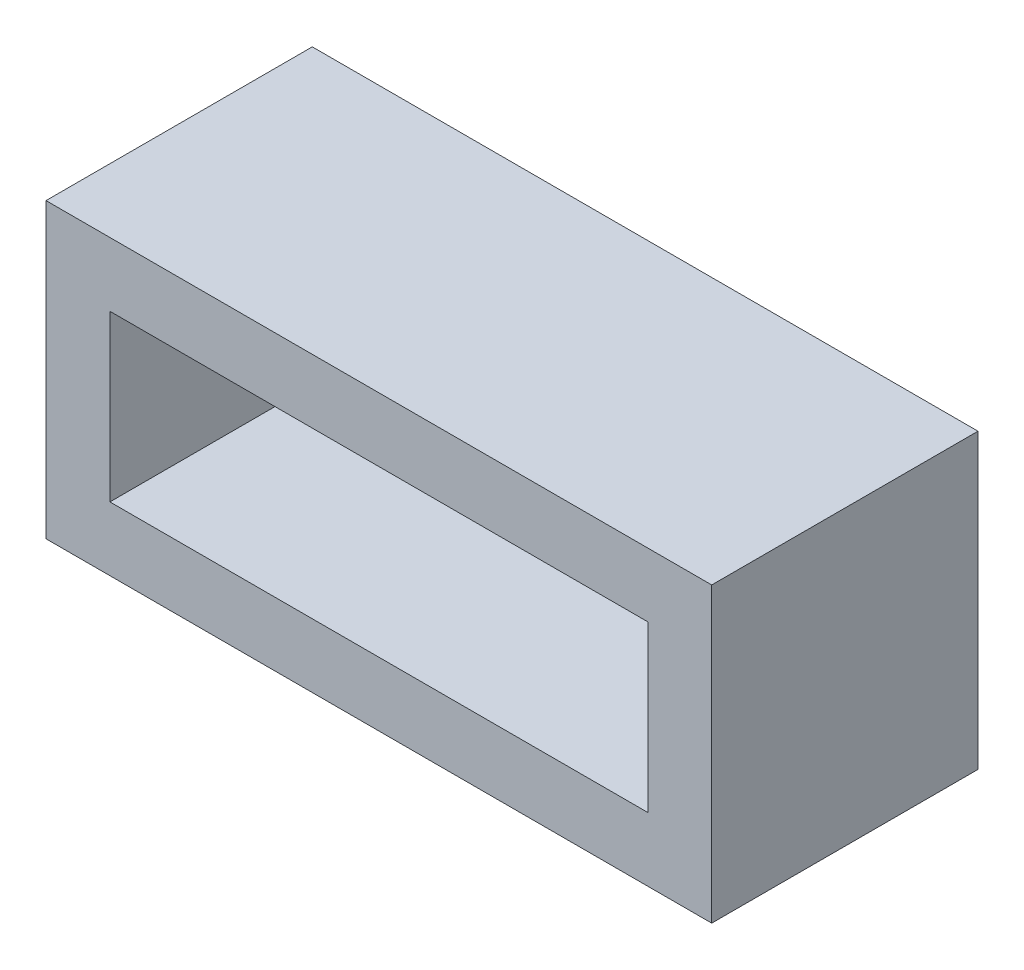
from build123d import *

# Parameters (mm, degrees)
SKETCH1_W           = 25
SKETCH1_H           = 11
SKETCH1_W_2         = 20.2
SKETCH1_H_2         = 6.2
BOSS_EXTRUDE1_DEPTH = 10


with BuildPart() as part:
    # Sketch1 → Boss-Extrude1 (new body)
    with BuildSketch(Plane.XY):
        Rectangle(SKETCH1_W, SKETCH1_H)
        Rectangle(SKETCH1_W_2, SKETCH1_H_2, mode=Mode.SUBTRACT)
    extrude(amount=BOSS_EXTRUDE1_DEPTH)


solid = part.part
